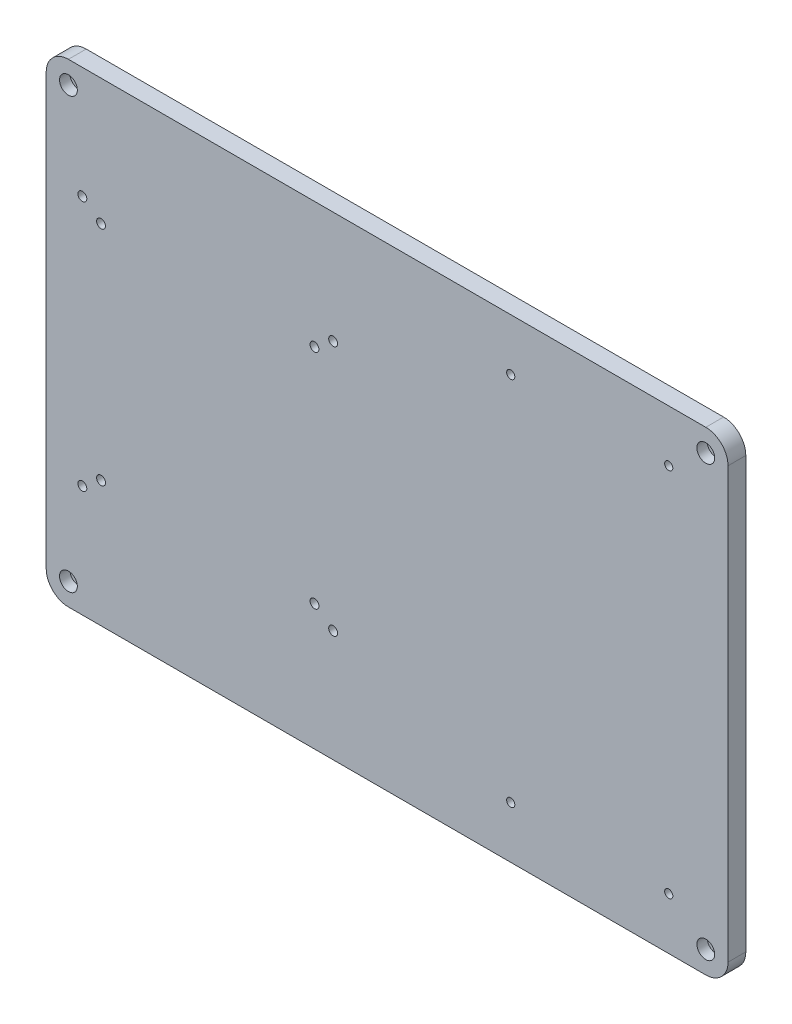
from build123d import *

# Parameters (mm, degrees)
BOSS_EXTRUDE1_DEPTH     = 6
SKETCH2_R               = 1.75
CUT_EXTRUDE1_DEPTH      = 10
SKETCH3_R               = 3
CUT_EXTRUDE2_DEPTH      = 3.5
SKETCH4_R               = 1.5
CUT_EXTRUDE3_DEPTH      = 141.2176879
CUT_EXTRUDE4_DEPTH      = 141.2176879
CUT_EXTRUDE4_DEPTH_BACK = 141.2176879
SKETCH5_R               = 1.375
SKETCH7_R               = 1.5
CUT_EXTRUDE6_DEPTH      = 141.2176879
SKETCH8_R               = 3
CUT_EXTRUDE7_DEPTH      = 3.5


with BuildPart() as part:
    # Sketch1 → Boss-Extrude1 (new body)
    with BuildSketch(Plane.XY):
        with BuildLine():
            Line((-107.5, 80), (107.5, 80))
            ThreePointArc((107.5, 80), (112.803300859, 77.803300859), (115, 72.5))
            Line((115, 72.5), (115, -72.5))
            ThreePointArc((115, -72.5), (112.803300859, -77.803300859), (107.5, -80))
            Line((107.5, -80), (-107.5, -80))
            ThreePointArc((-107.5, -80), (-112.803300859, -77.803300859), (-115, -72.5))
            Line((-115, -72.5), (-115, 72.5))
            ThreePointArc((-115, 72.5), (-112.803300859, 77.803300859), (-107.5, 80))
        make_face()
    extrude(amount=BOSS_EXTRUDE1_DEPTH)

    # Sketch2 → Cut-Extrude1 (cut)
    with BuildSketch(Plane.XY.offset(6)):
        with Locations((-107.5, -72.5)):
            Circle(SKETCH2_R)
        with Locations((-107.5, 72.5)):
            Circle(SKETCH2_R)
        with Locations((107.5, -72.5)):
            Circle(SKETCH2_R)
        with Locations((107.5, 72.5)):
            Circle(SKETCH2_R)
    extrude(amount=-CUT_EXTRUDE1_DEPTH, mode=Mode.SUBTRACT)

    # Sketch3 → Cut-Extrude2 (cut)
    with BuildSketch(Plane.XY.offset(6)):
        with Locations((-107.5, -72.5)):
            Circle(SKETCH3_R)
        with Locations((-107.5, 72.5)):
            Circle(SKETCH3_R)
        with Locations((107.5, 72.5)):
            Circle(SKETCH3_R)
        with Locations((107.5, -72.5)):
            Circle(SKETCH3_R)
    extrude(amount=-CUT_EXTRUDE2_DEPTH, mode=Mode.SUBTRACT)

    # Sketch4 → Cut-Extrude3 (cut, through all)
    with BuildSketch(Plane.XY.offset(6)):
        with Locations((-96.5, 37.5)):
            Circle(SKETCH4_R)
        with Locations((-96.5, -37.5)):
            Circle(SKETCH4_R)
        with Locations((-24.5, 37.5)):
            Circle(SKETCH4_R)
        with Locations((-24.5, -37.5)):
            Circle(SKETCH4_R)
    extrude(amount=-CUT_EXTRUDE3_DEPTH, mode=Mode.SUBTRACT)

    # Sketch5 → Cut-Extrude4 (cut, two sides: drawn at the far end of the back side and taken through both)
    with BuildSketch(Plane.XY.offset(6).offset(-CUT_EXTRUDE4_DEPTH_BACK)):
        with Locations((95, -62.5)):
            Circle(SKETCH5_R)
        with Locations((95, 62.5)):
            Circle(SKETCH5_R)
        with Locations((41.7, -62.5)):
            Circle(SKETCH5_R)
        with Locations((41.7, 62.5)):
            Circle(SKETCH5_R)
    extrude(amount=CUT_EXTRUDE4_DEPTH + CUT_EXTRUDE4_DEPTH_BACK, mode=Mode.SUBTRACT)

    # Sketch7 → Cut-Extrude6 (cut, through all)
    with BuildSketch(Plane.XY.offset(6)):
        with Locations((-102.8, 42.3)):
            Circle(SKETCH7_R)
        with Locations((-102.8, -42.3)):
            Circle(SKETCH7_R)
        with Locations((-18.2, -42.3)):
            Circle(SKETCH7_R)
        with Locations((-18.2, 42.3)):
            Circle(SKETCH7_R)
    extrude(amount=-CUT_EXTRUDE6_DEPTH, mode=Mode.SUBTRACT)

    # Sketch8 → Cut-Extrude7 (cut)
    with BuildSketch(Plane(origin=(0, 0, 0), x_dir=(-1, 0, 0), z_dir=(0, 0, -1))):
        with Locations((18.2, 42.3)):
            Circle(SKETCH8_R)
        with Locations((18.2, -42.3)):
            Circle(SKETCH8_R)
        with Locations((102.8, -42.3)):
            Circle(SKETCH8_R)
        with Locations((102.8, 42.3)):
            Circle(SKETCH8_R)
    extrude(amount=-CUT_EXTRUDE7_DEPTH, mode=Mode.SUBTRACT)


solid = part.part
